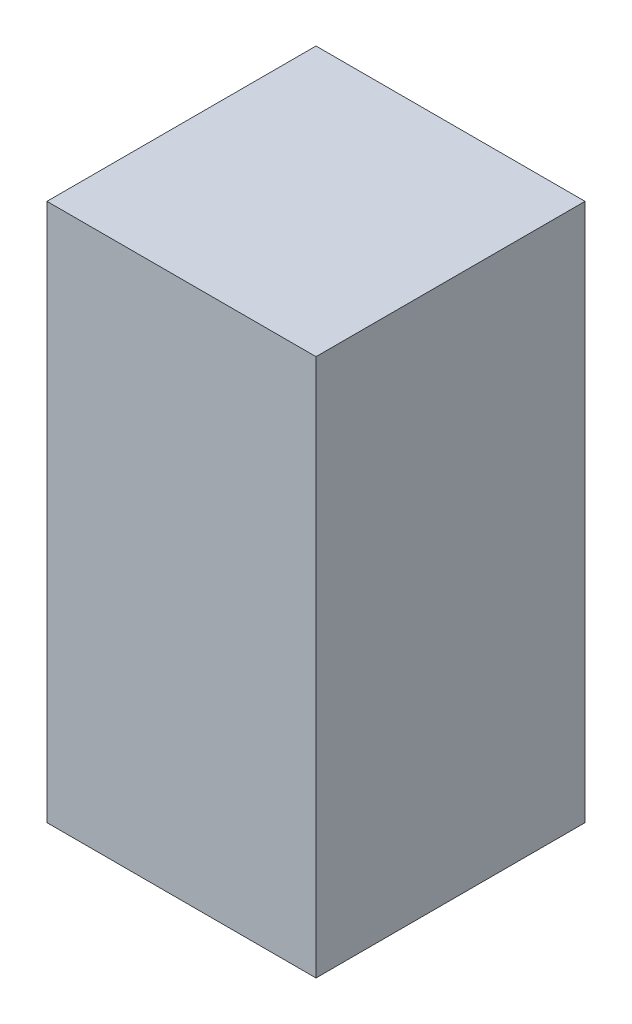
from build123d import *

# Parameters (mm, degrees)
PACK_LINEER_RULMAN_1_1_START = -385
SKETCH1_W                    = 30
SKETCH1_H                    = 60
PACK_LINEER_RULMAN_1_1_DEPTH = 30


with BuildPart() as part:
    # Sketch1 → PACK_lineer_rulman_1_1 (new body)
    with BuildSketch(Plane.XY.offset(PACK_LINEER_RULMAN_1_1_START)):
        with Locations((150, 500)):
            Rectangle(SKETCH1_W, SKETCH1_H)
    extrude(amount=-PACK_LINEER_RULMAN_1_1_DEPTH)


solid = part.part
